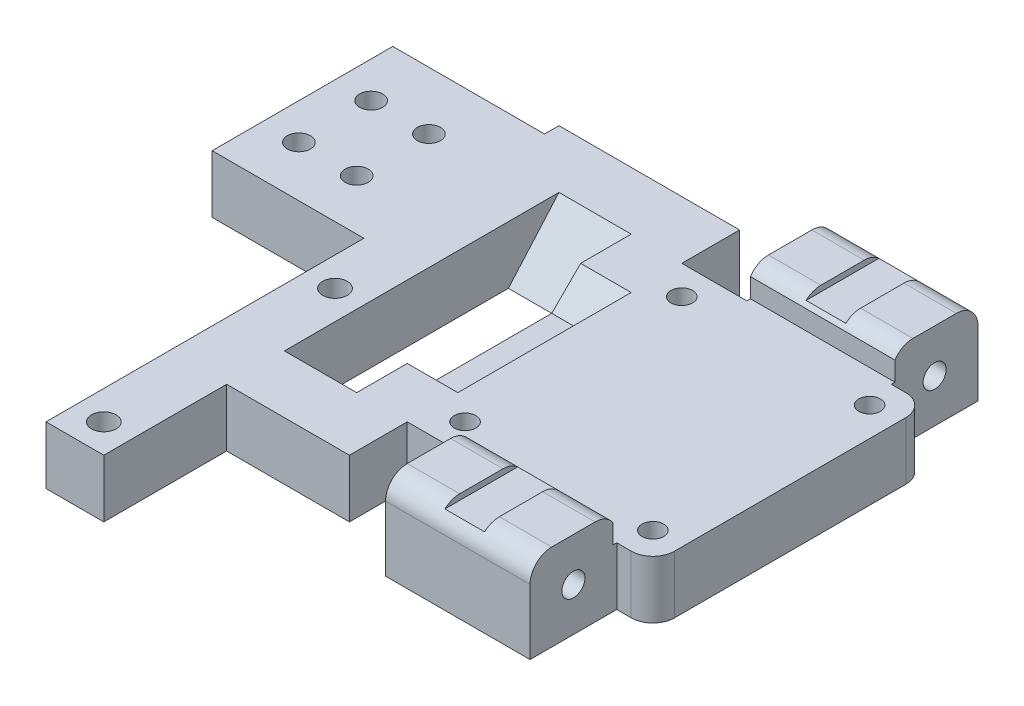
from build123d import *

# Parameters (mm, degrees)
SKETCH1_W            = 300
SKETCH1_H            = 20
BOSS_EXTRUDE1_DEPTH  = 8
SKETCH2_W            = 34
SKETCH2_H            = 8
BOSS_EXTRUDE2_DEPTH  = 9
SKETCH3_W            = 34
SKETCH3_H            = 8
BOSS_EXTRUDE3_DEPTH  = 9
SKETCH4_R            = 1.5
CUT_EXTRUDE1_DEPTH   = 302.504560496
SKETCH5_W            = 25
SKETCH5_H            = 8
BOSS_EXTRUDE4_DEPTH  = 17
SKETCH6_W            = 25
SKETCH6_H            = 8
BOSS_EXTRUDE5_DEPTH  = 17
SKETCH7_W            = 10
SKETCH7_H            = 38
CUT_EXTRUDE2_DEPTH   = 303.37890138
SKETCH8_W            = 7
SKETCH8_H            = 16
CUT_EXTRUDE3_DEPTH   = 4
CUT_EXTRUDE4_DEPTH   = 7
BOSS_EXTRUDE6_DEPTH  = 10
SKETCH12_W           = 8
SKETCH12_H           = 8
BOSS_EXTRUDE7_DEPTH  = 17
SKETCH13_R           = 1.7
CUT_EXTRUDE6_DEPTH   = 305.926220585
SKETCH14_W           = 20
SKETCH14_H           = 12
BOSS_EXTRUDE8_DEPTH  = 12
SKETCH15_R           = 1.6
CUT_EXTRUDE7_DEPTH   = 20
SKETCH16_W           = 20
SKETCH16_H           = 12
BOSS_EXTRUDE9_DEPTH  = 12
SKETCH17_R           = 1.6
CUT_EXTRUDE8_DEPTH   = 20
SKETCH18_W           = 20
SKETCH18_H           = 13
BOSS_EXTRUDE10_DEPTH = 12
SKETCH19_R           = 1.6
CUT_EXTRUDE9_DEPTH   = 20
SKETCH20_W           = 20
SKETCH20_H           = 13
BOSS_EXTRUDE11_DEPTH = 12
SKETCH21_R           = 1.6
CUT_EXTRUDE10_DEPTH  = 20
FILLET6_R            = 3
SKETCH28_W           = 198.881436238
SKETCH28_H           = 556.355103816
CUT_EXTRUDE14_DEPTH  = 220
SKETCH29_W           = 21
SKETCH29_H           = 8
BOSS_EXTRUDE12_DEPTH = 15
SKETCH30_W           = 21
SKETCH30_H           = 10
CUT_EXTRUDE15_DEPTH  = 306.057371653
SKETCH31_R           = 1.6
CUT_EXTRUDE16_DEPTH  = 306.057371653
FILLET7_R            = 3
SKETCH32_W           = 5.5
SKETCH32_H           = 70.463459777
CUT_EXTRUDE17_DEPTH  = 0.8
SKETCH33_W           = 20
SKETCH33_H           = 4.963841857
CUT_EXTRUDE18_DEPTH  = 0.5
SKETCH34_W           = 20
SKETCH34_H           = 11.942443484
CUT_EXTRUDE19_DEPTH  = 0.5


with BuildPart() as part:
    # Sketch1 → Boss-Extrude1 (new body)
    with BuildSketch(Plane(origin=(0, 0, 0), x_dir=(1, 0, 0), z_dir=(0, 1, 0))):
        with Locations((150, -10)):
            Rectangle(SKETCH1_W, SKETCH1_H)
    extrude(amount=BOSS_EXTRUDE1_DEPTH)

    # Sketch2 → Boss-Extrude2 (add)
    with BuildSketch(Plane.XY.offset(20)):
        with Locations((17, 4)):
            Rectangle(SKETCH2_W, SKETCH2_H)
        with Locations((283, 4)):
            Rectangle(SKETCH2_W, SKETCH2_H)
    extrude(amount=BOSS_EXTRUDE2_DEPTH)

    # Sketch3 → Boss-Extrude3 (add)
    with BuildSketch(Plane(origin=(0, 0, 0), x_dir=(-1, 0, 0), z_dir=(0, 0, -1))):
        with Locations((-17, 4)):
            Rectangle(SKETCH3_W, SKETCH3_H)
        with Locations((-283, 4)):
            Rectangle(SKETCH3_W, SKETCH3_H)
    extrude(amount=BOSS_EXTRUDE3_DEPTH)

    # Sketch4 → Cut-Extrude1 (cut, through all)
    with BuildSketch(Plane(origin=(0, 8, 0), x_dir=(1, 0, 0), z_dir=(0, 1, 0))):
        with Locations(Location((4, 5, 0), (0, 0, 270))):
            Circle(SKETCH4_R)
        with Locations(Location((30, 5, 0), (0, 0, 270))):
            Circle(SKETCH4_R)
        with Locations(Location((30, -25, 0), (0, 0, 270))):
            Circle(SKETCH4_R)
        with Locations(Location((4, -25, 0), (0, 0, 270))):
            Circle(SKETCH4_R)
        with Locations(Location((296, -25, 0), (0, 0, 270))):
            Circle(SKETCH4_R)
        with Locations(Location((296, 5, 0), (0, 0, 270))):
            Circle(SKETCH4_R)
        with Locations(Location((270, -25, 0), (0, 0, 270))):
            Circle(SKETCH4_R)
        with Locations(Location((270, 5, 0), (0, 0, 270))):
            Circle(SKETCH4_R)
    extrude(amount=-CUT_EXTRUDE1_DEPTH, mode=Mode.SUBTRACT)

    # Sketch5 → Boss-Extrude4 (add)
    with BuildSketch(Plane.XY.offset(20)):
        with Locations((253.5, 4)):
            Rectangle(SKETCH5_W, SKETCH5_H)
    extrude(amount=BOSS_EXTRUDE4_DEPTH)

    # Sketch6 → Boss-Extrude5 (add)
    with BuildSketch(Plane(origin=(0, 0, 0), x_dir=(-1, 0, 0), z_dir=(0, 0, -1))):
        with Locations((-253.5, 4)):
            Rectangle(SKETCH6_W, SKETCH6_H)
    extrude(amount=BOSS_EXTRUDE5_DEPTH)

    # Sketch7 → Cut-Extrude2 (cut, through all)
    with BuildSketch(Plane(origin=(0, 8, 0), x_dir=(1, 0, 0), z_dir=(0, 1, 0))):
        with Locations((254, -10)):
            Rectangle(SKETCH7_W, SKETCH7_H)
    extrude(amount=-CUT_EXTRUDE2_DEPTH, mode=Mode.SUBTRACT)

    # Sketch8 → Cut-Extrude3 (cut)
    with BuildSketch(Plane(origin=(0, 8, 0), x_dir=(1, 0, 0), z_dir=(0, 1, 0))):
        with Locations((262.5, -10)):
            Rectangle(SKETCH8_W, SKETCH8_H)
    extrude(amount=-CUT_EXTRUDE3_DEPTH, mode=Mode.SUBTRACT)

    # Sketch9 → Cut-Extrude4 (cut)
    with BuildSketch(Plane.ZY.offset(-259)):
        Polygon((18, 4), (22, 8), (18, 8), align=None)
        Polygon((2, 4), (-2, 8), (2, 8), align=None)
    extrude(amount=-CUT_EXTRUDE4_DEPTH, mode=Mode.SUBTRACT)

    # Sketch10 → Boss-Extrude6 (add)
    with BuildSketch(Plane.ZY.offset(-259)):
        Polygon((-2, 0), (-9, 8), (-9, 0), align=None)
        Polygon((29, 8), (22, 0), (29, 0), align=None)
    extrude(amount=BOSS_EXTRUDE6_DEPTH)

    # Sketch12 → Boss-Extrude7 (add)
    with BuildSketch(Plane.XY.offset(37)):
        with Locations((245, 4)):
            Rectangle(SKETCH12_W, SKETCH12_H)
    extrude(amount=BOSS_EXTRUDE7_DEPTH)

    # Sketch13 → Cut-Extrude6 (cut, through all)
    with BuildSketch(Plane(origin=(0, 8, 0), x_dir=(1, 0, 0), z_dir=(0, 1, 0))):
        with Locations(Location((245, -50, 0), (0, 0, 270))):
            Circle(SKETCH13_R)
        with Locations(Location((245, -18, 0), (0, 0, 270))):
            Circle(SKETCH13_R)
    extrude(amount=-CUT_EXTRUDE6_DEPTH, mode=Mode.SUBTRACT)

    # Sketch14 → Boss-Extrude8 (add)
    with BuildSketch(Plane.XY.offset(29)):
        with Locations((285, 6)):
            Rectangle(SKETCH14_W, SKETCH14_H)
    extrude(amount=BOSS_EXTRUDE8_DEPTH)

    # Sketch15 → Cut-Extrude7 (cut)
    with BuildSketch(Plane(origin=(295, 0, 0), x_dir=(0, 0, -1), z_dir=(1, 0, 0))):
        with Locations((-35, 6)):
            Circle(SKETCH15_R)
    extrude(amount=-CUT_EXTRUDE7_DEPTH, mode=Mode.SUBTRACT)

    # Sketch16 → Boss-Extrude9 (add)
    with BuildSketch(Plane(origin=(0, 0, -9), x_dir=(-1, 0, 0), z_dir=(0, 0, -1))):
        with Locations((-285, 6)):
            Rectangle(SKETCH16_W, SKETCH16_H)
    extrude(amount=BOSS_EXTRUDE9_DEPTH)

    # Sketch17 → Cut-Extrude8 (cut)
    with BuildSketch(Plane(origin=(295, 0, 0), x_dir=(0, 0, -1), z_dir=(1, 0, 0))):
        with Locations((15, 6)):
            Circle(SKETCH17_R)
    extrude(amount=-CUT_EXTRUDE8_DEPTH, mode=Mode.SUBTRACT)

    # Sketch18 → Boss-Extrude10 (add)
    with BuildSketch(Plane(origin=(0, 0, -9), x_dir=(-1, 0, 0), z_dir=(0, 0, -1))):
        with Locations((-15, 6.5)):
            Rectangle(SKETCH18_W, SKETCH18_H)
    extrude(amount=BOSS_EXTRUDE10_DEPTH)

    # Sketch19 → Cut-Extrude9 (cut)
    with BuildSketch(Plane.ZY.offset(-5)):
        with Locations((-15, 8)):
            Circle(SKETCH19_R)
    extrude(amount=-CUT_EXTRUDE9_DEPTH, mode=Mode.SUBTRACT)

    # Sketch20 → Boss-Extrude11 (add)
    with BuildSketch(Plane.XY.offset(29)):
        with Locations((15, 6.5)):
            Rectangle(SKETCH20_W, SKETCH20_H)
    extrude(amount=BOSS_EXTRUDE11_DEPTH)

    # Sketch21 → Cut-Extrude10 (cut)
    with BuildSketch(Plane.ZY.offset(-5)):
        with Locations((35, 8)):
            Circle(SKETCH21_R)
    extrude(amount=-CUT_EXTRUDE10_DEPTH, mode=Mode.SUBTRACT)

    # Fillet6
    fillet6_edges = [part.edges().sort_by_distance(p)[0] for p in [
        (285, 12, 29),
        (285, 12, 41),
        (285, 12, -9),
        (285, 12, -21),
        (15, 13, -9),
        (15, 13, -21),
        (15, 13, 29),
        (15, 13, 41),
    ]]
    fillet(fillet6_edges, radius=FILLET6_R)

    # Sketch28 → Cut-Extrude14 (cut)
    with BuildSketch(Plane.ZY):
        with Locations((-20.495432896, -60.484201615)):
            Rectangle(SKETCH28_W, SKETCH28_H)
    extrude(amount=-CUT_EXTRUDE14_DEPTH, mode=Mode.SUBTRACT)

    # Sketch29 → Boss-Extrude12 (add)
    with BuildSketch(Plane(origin=(0, 0, 0), x_dir=(-1, 0, 0), z_dir=(0, 0, -1))):
        with Locations((-230.5, 4)):
            Rectangle(SKETCH29_W, SKETCH29_H)
    extrude(amount=BOSS_EXTRUDE12_DEPTH)

    # Sketch30 → Cut-Extrude15 (cut, through all)
    with BuildSketch(Plane(origin=(0, 0, 0), x_dir=(-1, 0, 0), z_dir=(0, -1, 0))):
        with Locations((-230.5, -15)):
            Rectangle(SKETCH30_W, SKETCH30_H)
    extrude(amount=-CUT_EXTRUDE15_DEPTH, mode=Mode.SUBTRACT)

    # Sketch31 → Cut-Extrude16 (cut, through all)
    with BuildSketch(Plane(origin=(0, 0, 0), x_dir=(-1, 0, 0), z_dir=(0, -1, 0))):
        with Locations(Location((-225, 7, 0), (0, 0, 90))):
            Circle(SKETCH31_R)
        with Locations(Location((-225, -3, 0), (0, 0, 90))):
            Circle(SKETCH31_R)
        with Locations(Location((-233, 7, 0), (0, 0, 90))):
            Circle(SKETCH31_R)
        with Locations(Location((-233, -3, 0), (0, 0, 90))):
            Circle(SKETCH31_R)
    extrude(amount=-CUT_EXTRUDE16_DEPTH, mode=Mode.SUBTRACT)

    # Fillet7
    fillet7_edges = [part.edges().sort_by_distance(p)[0] for p in [
        (300, 4, 29),
        (300, 4, -9),
    ]]
    fillet(fillet7_edges, radius=FILLET7_R)

    # Sketch32 → Cut-Extrude17 (cut)
    with BuildSketch(Plane(origin=(0, 12, 0), x_dir=(1, 0, 0), z_dir=(0, 1, 0))):
        with Locations((285, -7.2213573)):
            Rectangle(SKETCH32_W, SKETCH32_H)
    extrude(amount=-CUT_EXTRUDE17_DEPTH, mode=Mode.SUBTRACT)

    # Sketch33 → Cut-Extrude18 (cut)
    with BuildSketch(Plane(origin=(0, 0, 29), x_dir=(-1, 0, 0), z_dir=(0, 0, -1))):
        with Locations((-285, 10.481920928)):
            Rectangle(SKETCH33_W, SKETCH33_H)
    extrude(amount=-CUT_EXTRUDE18_DEPTH, mode=Mode.SUBTRACT)

    # Sketch34 → Cut-Extrude19 (cut)
    with BuildSketch(Plane.XY.offset(-9)):
        with Locations((285, 13.971221742)):
            Rectangle(SKETCH34_W, SKETCH34_H)
    extrude(amount=-CUT_EXTRUDE19_DEPTH, mode=Mode.SUBTRACT)


solid = part.part
